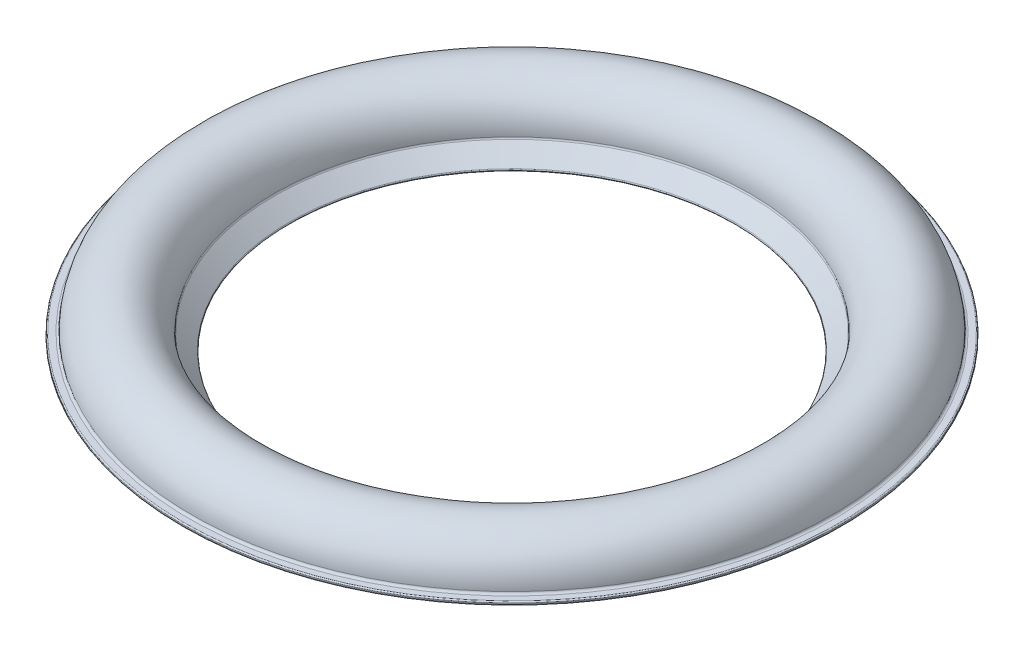
from build123d import *


with BuildPart() as part:
    # Sketch 252 → Повернуть3 (revolve)
    with BuildSketch(Plane.XY, mode=Mode.PRIVATE) as revolve_3_sk:
        with BuildLine():
            Line((95.343872324, 89.637023658), (95.687744648, 89.274047316))
            ThreePointArc((95.687744648, 89.274047316), (96.037212409, 89.118102155), (96.394593314, 89.254943298))
            Line((96.394593314, 89.254943298), (102.855572201, 95.375870665))
            Line((102.855572201, 95.375870665), (103.467612479, 95.987910943))
            ThreePointArc((103.467612479, 95.987910943), (103.686425269, 96.317296996), (103.760448118, 96.705748828))
            ThreePointArc((103.760448118, 96.705748828), (119.909002246, 112.876748248), (135.752604927, 96.406858244))
            ThreePointArc((135.752604927, 96.406858244), (136.034742253, 95.680815933), (136.752172307, 95.377446479))
            Line((136.752172307, 95.377446479), (140.759526839, 95.377446479))
            ThreePointArc((140.759526839, 95.377446479), (141.11308023, 95.523893089), (141.259526839, 95.877446479))
            Line((141.259526839, 95.877446479), (141.259526839, 96.377446479))
            ThreePointArc((141.259526839, 96.377446479), (141.11308023, 96.73099987), (140.759526839, 96.877446479))
            Line((140.759526839, 96.877446479), (138.232480041, 96.877446479))
            ThreePointArc((138.232480041, 96.877446479), (137.544749736, 97.151480208), (137.23394203, 97.823392425))
            ThreePointArc((137.23394203, 97.823392425), (119.492084975, 114.375402784), (102.264364743, 97.288911212))
            ThreePointArc((102.264364743, 97.288911212), (102.178557417, 96.906520614), (101.952385842, 96.586470798))
            Line((101.952385842, 96.586470798), (95.362976342, 90.343872324))
            ThreePointArc((95.362976342, 90.343872324), (95.207031181, 89.994404563), (95.343872324, 89.637023658))
        make_face()
    revolve(revolve_3_sk.sketch.rotate(Axis((0, 0, 0), (0, 1, 0)), 90), axis=Axis((0, 0, 0), (0, 1, 0)))


solid = part.part
